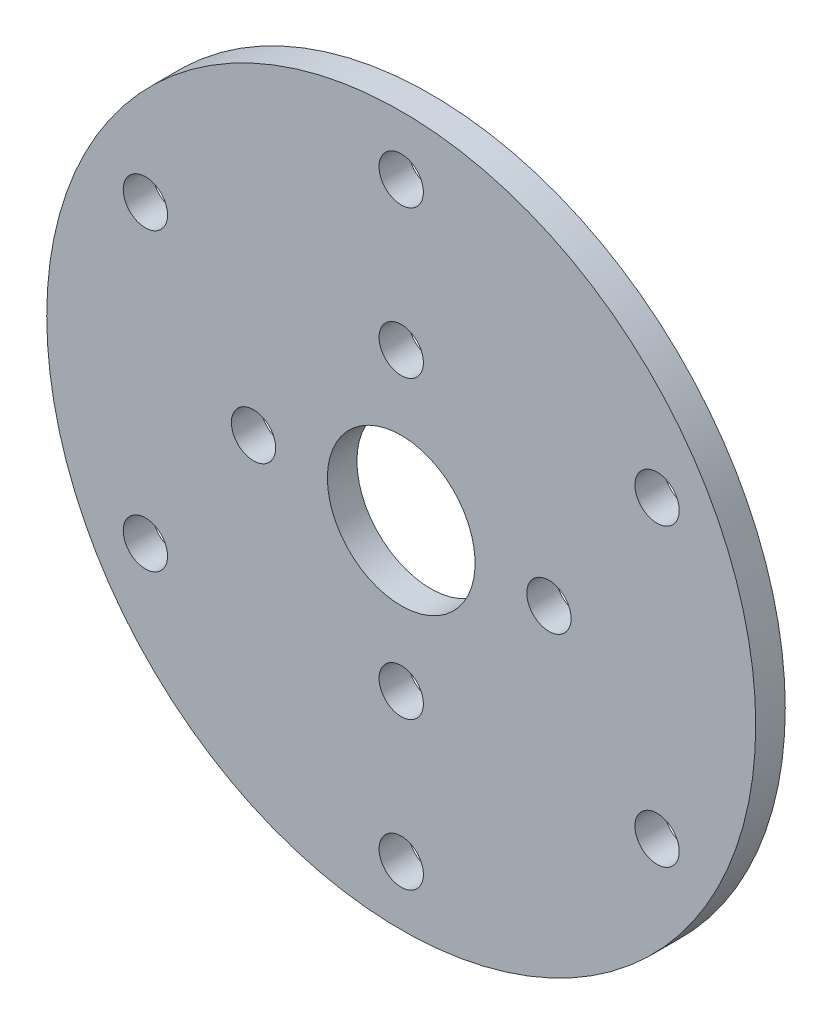
from build123d import *

# Parameters (mm, degrees)
SKETCH_1_R      = 24
SKETCH_1_R_2    = 1.5
SKETCH_1_R_3    = 5
EXTRUDE_1_DEPTH = 2


with BuildPart() as part:
    # 草图1 → 凸台-拉伸1 (new body)
    with BuildSketch(Plane.XY.offset(2)):
        with Locations(Location((0, 0, 0), (0, 0, 180))):
            Circle(SKETCH_1_R)
        with Locations(Location((-17.320508076, 10, 0), (0, 0, 180))):
            Circle(SKETCH_1_R_2, mode=Mode.SUBTRACT)
        with Locations(Location((0, -20, 0), (0, 0, 180))):
            Circle(SKETCH_1_R_2, mode=Mode.SUBTRACT)
        with Locations(Location((17.320508076, 10, 0), (0, 0, 180))):
            Circle(SKETCH_1_R_2, mode=Mode.SUBTRACT)
        with Locations(Location((0, 0, 0), (0, 0, 180))):
            Circle(SKETCH_1_R_3, mode=Mode.SUBTRACT)
        with Locations(Location((0, 20, 0), (0, 0, 180))):
            Circle(SKETCH_1_R_2, mode=Mode.SUBTRACT)
        with Locations(Location((17.320508076, -10, 0), (0, 0, 180))):
            Circle(SKETCH_1_R_2, mode=Mode.SUBTRACT)
        with Locations(Location((-17.320508076, -10, 0), (0, 0, 180))):
            Circle(SKETCH_1_R_2, mode=Mode.SUBTRACT)
        with Locations(Location((0, 10, 0), (0, 0, 180))):
            Circle(SKETCH_1_R_2, mode=Mode.SUBTRACT)
        with Locations(Location((-10, 0, 0), (0, 0, 180))):
            Circle(SKETCH_1_R_2, mode=Mode.SUBTRACT)
        with Locations(Location((0, -10, 0), (0, 0, 180))):
            Circle(SKETCH_1_R_2, mode=Mode.SUBTRACT)
        with Locations(Location((10, 0, 0), (0, 0, 180))):
            Circle(SKETCH_1_R_2, mode=Mode.SUBTRACT)
    extrude(amount=-EXTRUDE_1_DEPTH)


solid = part.part
